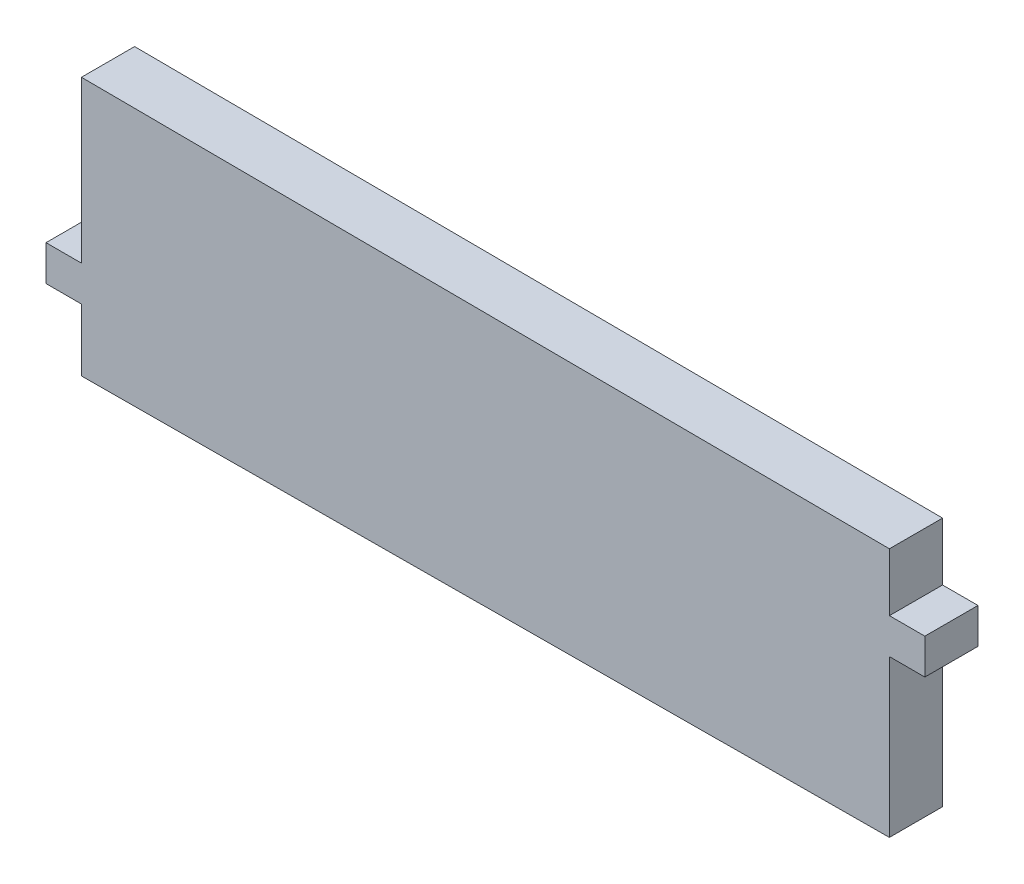
from build123d import *

# Parameters (mm, degrees)
BOSS_EXTRUDE1_DEPTH = 4.7625


with BuildPart() as part:
    # Sketch1 → Boss-Extrude1 (new body)
    with BuildSketch(Plane.XY):
        Polygon((15.805910266, -23.286367498), (12.630910266, -23.286367498), (12.630910266, -26.461367498), (15.805910266, -26.461367498), (15.805910266, -32.043255404), (88.195910266, -31.653426145), (88.195910266, -17.622167498), (91.370910266, -17.622167498), (91.370910266, -14.447167498), (88.195910266, -14.447167498), (88.195910266, -9.256041655), (15.805910266, -8.865195629), align=None)
    extrude(amount=BOSS_EXTRUDE1_DEPTH)


solid = part.part
